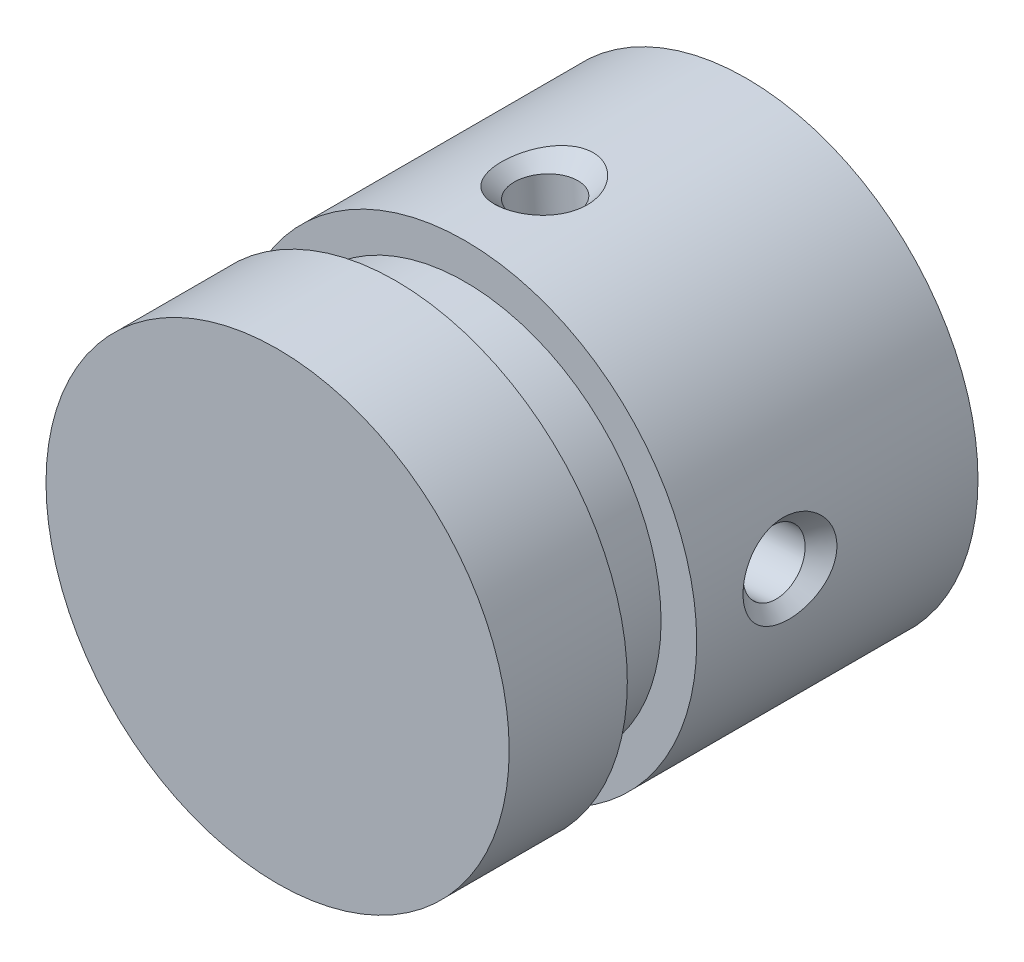
from build123d import *

# Parameters (mm, degrees)
SKETCH1_R           = 12.35
BOSS_EXTRUDE1_DEPTH = 25
CIRPATTERN1_COUNT   = 4
SKETCH7_W           = 3.7
SKETCH7_H           = 1.9


with BuildPart() as part:
    # Sketch1 → Boss-Extrude1 (new body)
    with BuildSketch(Plane.XY):
        Circle(SKETCH1_R)
    extrude(amount=BOSS_EXTRUDE1_DEPTH)

    # Sketch2 → M4x0.7 Tapped Hole1 (revolve, cut)
    with BuildSketch(Plane(origin=(-0.784484958, 12.325059162, 10), x_dir=(-0.9979804989599389, -0.06352104923308127, 0), z_dir=(0, 0, 1))):
        Polygon((0, 0), (0, 9.991420021), (1.65, 9), (1.65, 0.85), (2.5, 0), align=None)
    m4x0_7_tapped_hole1 = revolve(axis=Axis((-1.187843621, 18.662235331, 10), (0.06352104923308129, -0.9979804989599389, 0)), mode=Mode.SUBTRACT)

    # CirPattern1: M4x0.7 Tapped Hole1 ×4 about axis
    cirpattern1_axis = Axis((0, 0, 25), (0, 0, -1))
    for i in range(1, CIRPATTERN1_COUNT):
        add(m4x0_7_tapped_hole1.rotate(cirpattern1_axis, i * 360 / CIRPATTERN1_COUNT), mode=Mode.SUBTRACT)

    # Sketch7 → Cut-Revolve1 (revolve, cut)
    with BuildSketch(Plane(origin=(0, 0, 0), x_dir=(0, 0, -1), z_dir=(1, 0, 0)), mode=Mode.PRIVATE) as cut_revolve1_sk:
        with Locations((-16.85, 11.4)):
            Rectangle(SKETCH7_W, SKETCH7_H)
    revolve(cut_revolve1_sk.sketch.rotate(Axis((0, 0, 25), (0, 0, -1)), 90), axis=Axis((0, 0, 25), (0, 0, -1)), mode=Mode.SUBTRACT)


solid = part.part
